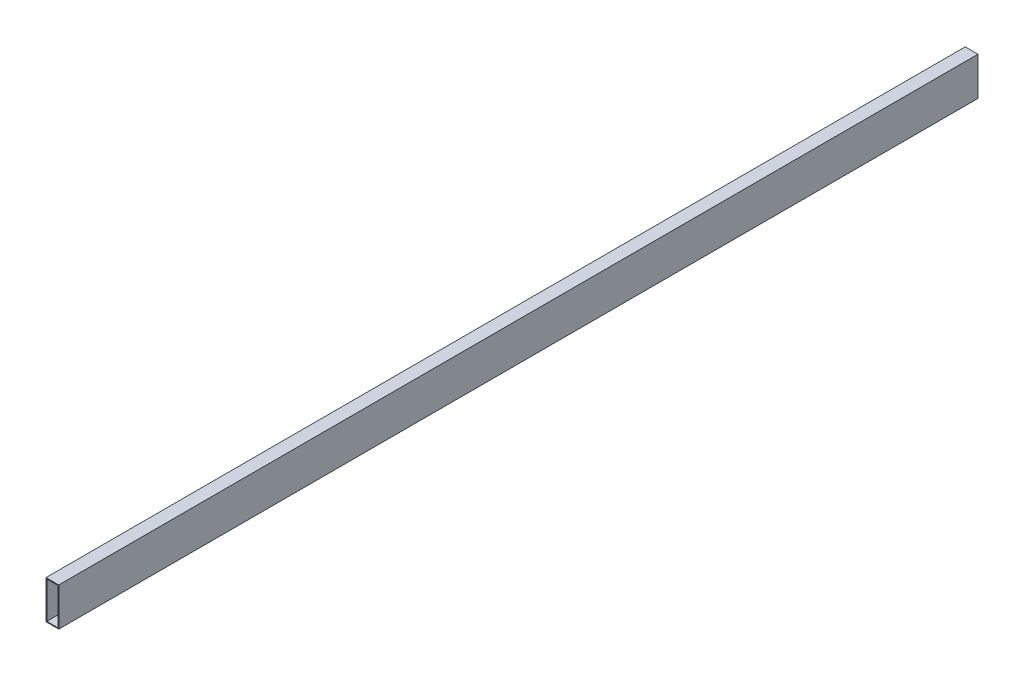
from build123d import *

# Parameters (mm, degrees)
SKETCH1_W           = 50.8
SKETCH1_H           = 152.4
BOSS_EXTRUDE1_DEPTH = 3657.6
SHELL1_T            = -3.175


with BuildPart() as part:
    # Sketch1 → Boss-Extrude1 (new body)
    with BuildSketch(Plane.XY):
        with Locations((25.4, 76.2)):
            Rectangle(SKETCH1_W, SKETCH1_H)
    extrude(amount=BOSS_EXTRUDE1_DEPTH)

    # Shell1
    shell1_openings = [part.faces().sort_by_distance(p)[0] for p in [
        (25.4, 76.2, 3657.6),
        (25.4, 76.2, 0),
    ]]
    offset(amount=SHELL1_T, openings=shell1_openings, kind=Kind.INTERSECTION)


solid = part.part
